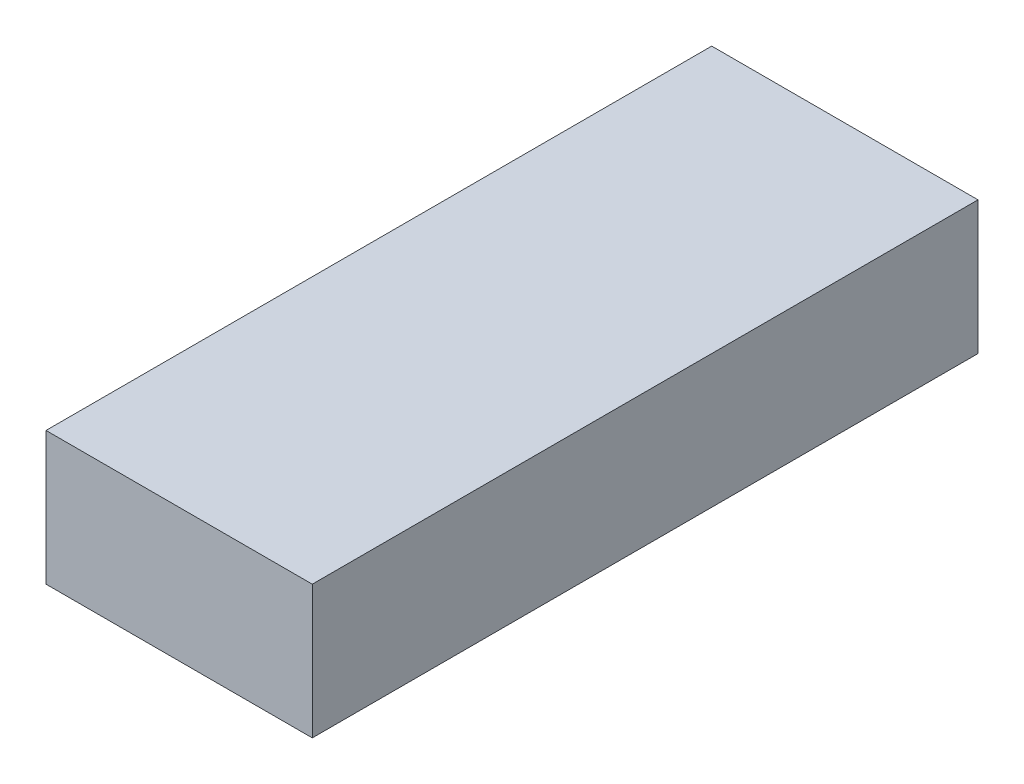
from build123d import *

# Parameters (mm, degrees)
SKETCH1_W           = 25.4
SKETCH1_H           = 63.5
BOSS_EXTRUDE1_DEPTH = 12.7


with BuildPart() as part:
    # Sketch1 → Boss-Extrude1 (new body)
    with BuildSketch(Plane(origin=(0, 0, 0), x_dir=(1, 0, 0), z_dir=(0, 1, 0))):
        with Locations((12.7, 31.75)):
            Rectangle(SKETCH1_W, SKETCH1_H)
    extrude(amount=BOSS_EXTRUDE1_DEPTH)


solid = part.part
